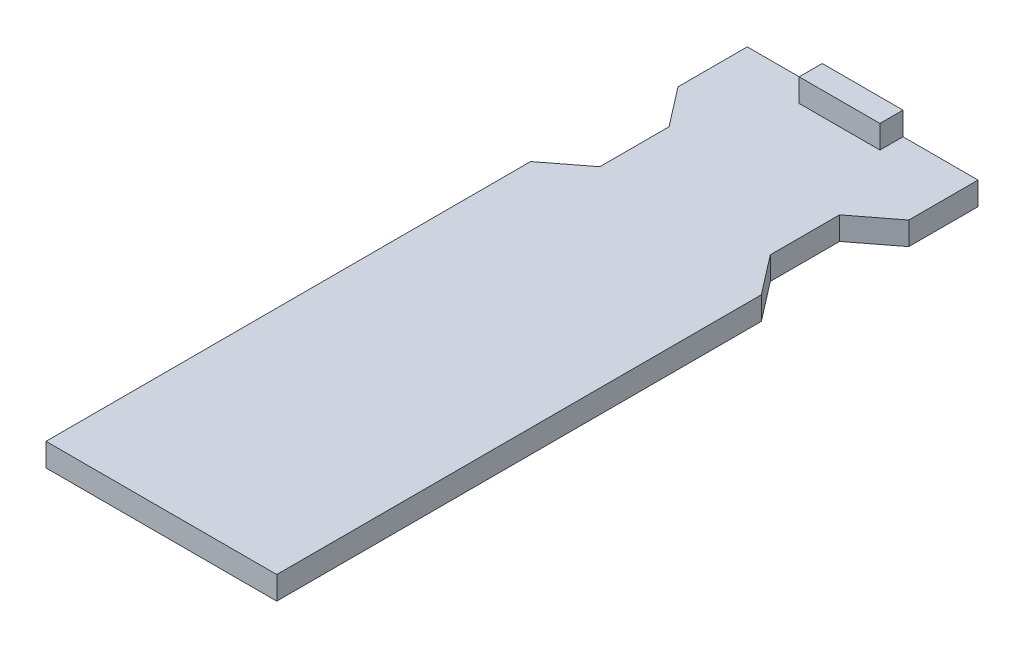
from build123d import *

# Parameters (mm, degrees)
BOSS_EXTRUDE1_DEPTH = 2
SKETCH2_W           = 7
SKETCH2_H           = 2
BOSS_EXTRUDE2_DEPTH = 2


with BuildPart() as part:
    # Sketch1 → Boss-Extrude1 (new body)
    with BuildSketch(Plane(origin=(0, 0, 0), x_dir=(1, 0, 0), z_dir=(0, 1, 0))):
        Polygon((0.77930974, 60), (0.77930974, 54), (3.38965487, 50.61034513), (3.38965487, 44.61034513), (0, 42), (0, 0), (20, 0), (20, 42), (17.38965487, 45.38965487), (17.38965487, 51.38965487), (20.77930974, 54), (20.77930974, 60), align=None)
    extrude(amount=BOSS_EXTRUDE1_DEPTH)


with BuildPart() as body_2:
    # Sketch2 → Boss-Extrude2 (new body)
    with BuildSketch(Plane(origin=(0, 2, 0), x_dir=(1, 0, 0), z_dir=(0, 1, 0))):
        with Locations((10.77930974, 59)):
            Rectangle(SKETCH2_W, SKETCH2_H)
    extrude(amount=BOSS_EXTRUDE2_DEPTH)


solid = Compound([part.part, body_2.part])
